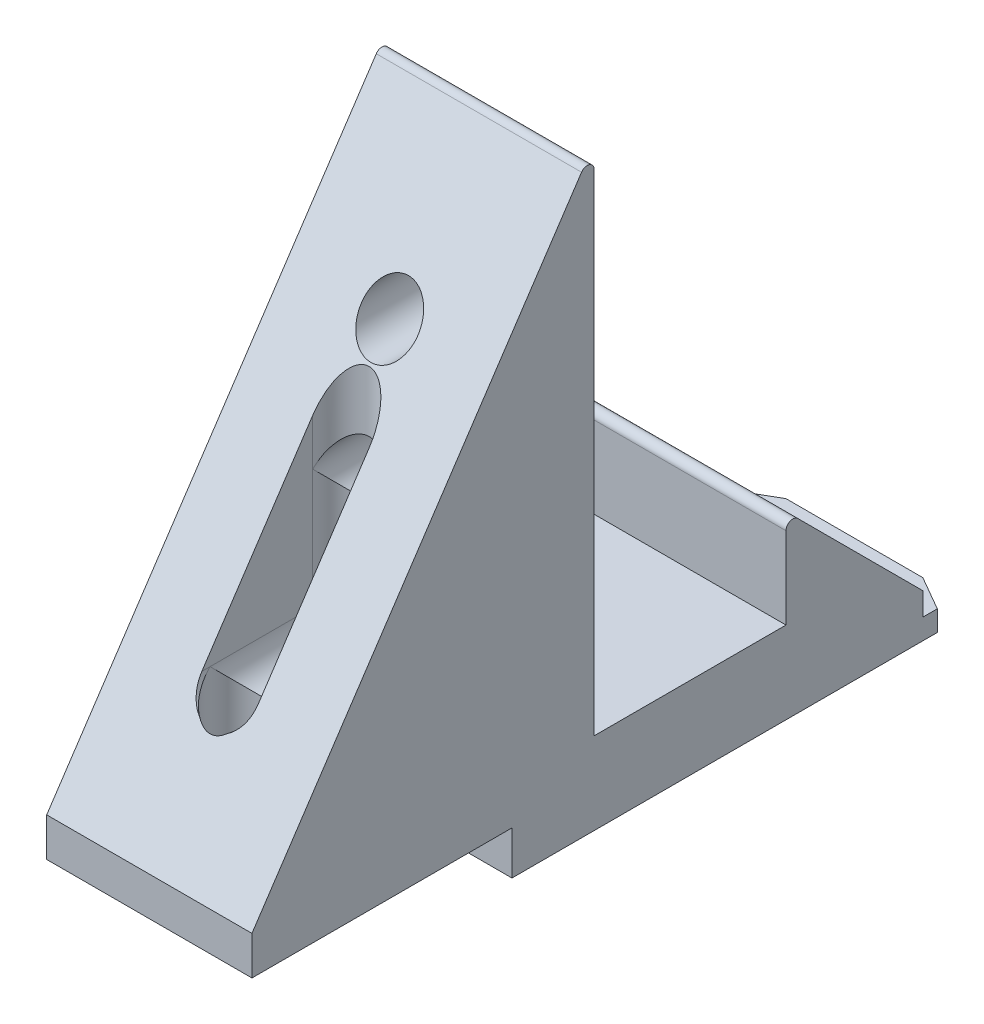
from build123d import *

# Parameters (mm, degrees)
BOSS_EXTRUDE1_DEPTH  = 15
FILLET1_R            = 1
SKETCH6_W            = 30
SKETCH6_H            = 38
CUT_EXTRUDE2_DEPTH   = 6.35
M4_CLEARANCE_HOLE1_D = 4.5
CUT_EXTRUDE3_START   = -5
SKETCH11_R           = 4.125
CUT_EXTRUDE3_DEPTH   = 40.35
M4_CLEARANCE_HOLE2_D = 4.5
CUT_EXTRUDE4_START   = -4
SKETCH15_R           = 4.125
CUT_EXTRUDE4_DEPTH   = 78.35
SKETCH16_W           = 22.054388556
SKETCH16_H           = 29.268630824
CUT_EXTRUDE6_DEPTH   = 8.25
SKETCH18_W           = 30
SKETCH18_H           = 5
BOSS_EXTRUDE2_DEPTH  = 3
CHAMFER1_SIZE        = 5
CHAMFER1_SIZE2       = 2.886751346


with BuildPart() as part:
    # Sketch2 → Boss-Extrude1 (new, symmetric)
    with BuildSketch(Plane(origin=(0, 0, 0), x_dir=(0, 0, -1), z_dir=(1, 0, 0))):
        Polygon((0, 5.65), (0, 80.65), (-50, 5.65), (-50, 0), (-50, -6.35), (48.05, -6.35), (48.05, 0), (28.05, 20), (28.05, 5.65), align=None)
    extrude(amount=BOSS_EXTRUDE1_DEPTH, both=True)

    # Fillet1
    fillet1_edges = [part.edges().sort_by_distance(p)[0] for p in [
        (0, 80.65, 0),
        (0, 20, -28.05),
    ]]
    fillet(fillet1_edges, radius=FILLET1_R)

    # Sketch6 → Cut-Extrude2 (cut)
    with BuildSketch(Plane.XZ.offset(6.35)):
        with Locations((0, 31)):
            Rectangle(SKETCH6_W, SKETCH6_H)
    extrude(amount=-CUT_EXTRUDE2_DEPTH, mode=Mode.SUBTRACT)

    # M4 Clearance Hole1 (through all)
    with Locations(Plane(origin=(0, 0, 0), x_dir=(-1, 0, 0), z_dir=(0, 0, -1))):
        with Locations((0, 58.347224362), (0, 40.847224362), (0, 23.347224362)):
            Hole(M4_CLEARANCE_HOLE1_D / 2)

    # Sketch11 → Cut-Extrude3 (cut)
    with BuildSketch(Plane(origin=(0, 0, 0), x_dir=(-1, 0, 0), z_dir=(0, 0, -1)).offset(CUT_EXTRUDE3_START)):
        with Locations((0, 58.347224362)):
            Circle(SKETCH11_R)
        with Locations((0, 40.847224362)):
            Circle(SKETCH11_R)
        with Locations((0, 23.347224362)):
            Circle(SKETCH11_R)
    extrude(amount=-CUT_EXTRUDE3_DEPTH, mode=Mode.SUBTRACT)

    # M4 Clearance Hole2 (through all)
    with Locations(Plane(origin=(0, 0, 0), x_dir=(-1, 0, 0), z_dir=(0, -1, 0))):
        with Locations((0, -37), (0, -22)):
            Hole(M4_CLEARANCE_HOLE2_D / 2)

    # Sketch15 → Cut-Extrude4 (cut)
    with BuildSketch(Plane.XZ.offset(CUT_EXTRUDE4_START)):
        with Locations(Location((0, 37, 0), (0, 0, 270))):
            Circle(SKETCH15_R)
        with Locations(Location((0, 22, 0), (0, 0, 270))):
            Circle(SKETCH15_R)
    extrude(amount=-CUT_EXTRUDE4_DEPTH, mode=Mode.SUBTRACT)

    # Sketch16 → Cut-Extrude6 (cut)
    with BuildSketch(Plane(origin=(-4.125, 0, 0), x_dir=(0, 0, -1), z_dir=(1, 0, 0))):
        with Locations((-33.027194278, 37.981539774)):
            Rectangle(SKETCH16_W, SKETCH16_H)
    extrude(amount=CUT_EXTRUDE6_DEPTH, mode=Mode.SUBTRACT)

    # Sketch18 → Boss-Extrude2 (add)
    with BuildSketch(Plane.XZ.offset(6.35)):
        with Locations((0, -50.55)):
            Rectangle(SKETCH18_W, SKETCH18_H)
    extrude(amount=-BOSS_EXTRUDE2_DEPTH)

    # Chamfer1
    chamfer1_edges = [part.edges().sort_by_distance(p)[0] for p in [
        (-15, -4.85, -53.05),
        (15, -4.85, -53.05),
    ]]
    chamfer1_side = [part.faces().sort_by_distance(p)[0] for p in [
        (0, -4.85, -53.05),
    ]]
    chamfer(chamfer1_edges, length=CHAMFER1_SIZE, length2=CHAMFER1_SIZE2, reference=chamfer1_side[0])


solid = part.part
